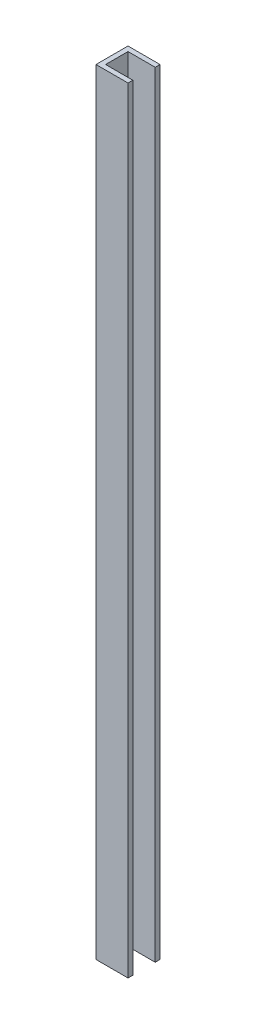
from build123d import *

# Parameters (mm, degrees)
BOSS_EXTRUDE1_DEPTH = 121


with BuildPart() as part:
    # Sketch2 → Boss-Extrude1 (new, symmetric)
    with BuildSketch(Plane(origin=(0, 0, 0), x_dir=(1, 0, 0), z_dir=(0, 1, 0))):
        Polygon((-5, 5), (-5, -5), (5, -5), (5, -3.5), (-3.5, -3.5), (-3.5, 3.5), (5, 3.5), (5, 5), align=None)
    extrude(amount=BOSS_EXTRUDE1_DEPTH, both=True)


solid = part.part
